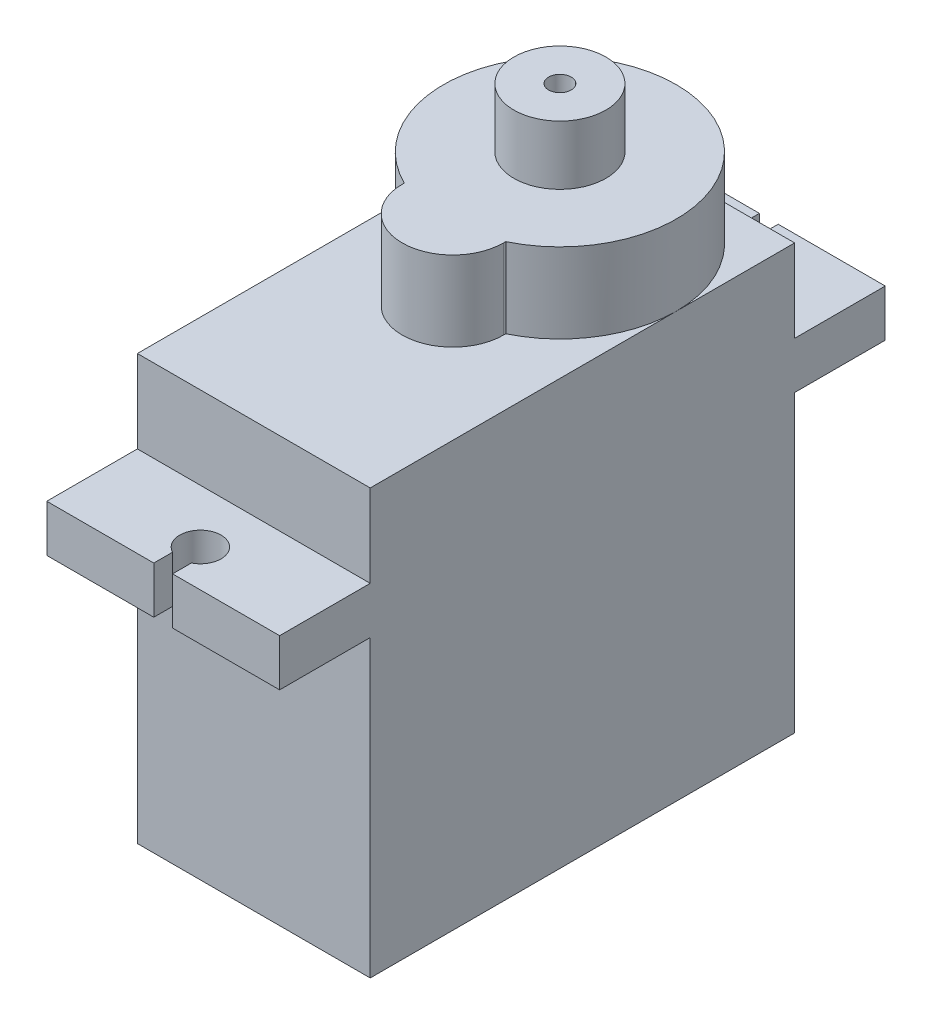
from build123d import *

# Parameters (mm, degrees)
IZIM1_W                     = 12.4
IZIM1_H                     = 22.6
Y_KSEKLIK_EKSTR_ZYON1_DEPTH = 22.6
Y_KSEKLIK_EKSTR_ZYON2_DEPTH = 2.5
IZIM3_W                     = 3.6
IZIM3_H                     = 3
Y_KSEKLIK_EKSTR_ZYON3_DEPTH = 1.2
IZIM4_R                     = 6.2
Y_KSEKLIK_EKSTR_ZYON4_DEPTH = 4.25
IZIM5_R                     = 2.45
IZIM5_R_2                   = 0.6
Y_KSEKLIK_EKSTR_ZYON6_DEPTH = 3.15
IZIM6_W                     = 0.1
IZIM6_H                     = 1.2
KES_EKSTR_ZYON1_DEPTH       = 3
RADYUS1_R                   = 0.5


with BuildPart() as part:
    # Çizim1 → Yükseklik-Ekstrüzyon1 (new body)
    with BuildSketch(Plane(origin=(0, 0, 0), x_dir=(1, 0, 0), z_dir=(0, 1, 0))):
        Rectangle(IZIM1_W, IZIM1_H)
    extrude(amount=Y_KSEKLIK_EKSTR_ZYON1_DEPTH)

    # Çizim2 → Yükseklik-Ekstrüzyon2 (add)
    with BuildSketch(Plane(origin=(0, 18.2, 0), x_dir=(1, 0, 0), z_dir=(0, 1, 0))):
        with BuildLine():
            Line((-6.2, 16.125), (-6.2, -16.125))
            Line((-6.2, -16.125), (-0.5, -16.125))
            Line((-0.5, -16.125), (-0.5, -15.125))
            ThreePointArc((-0.5, -15.125), (-0.574456265, -13.207120951), (1.1, -14.145204103))
            ThreePointArc((1.1, -14.145204103), (0.938083152, -14.719660368), (0.5, -15.125))
            Line((0.5, -15.125), (0.5, -16.125))
            Line((0.5, -16.125), (6.2, -16.125))
            Line((6.2, -16.125), (6.2, 16.125))
            Line((6.2, 16.125), (0.5, 16.125))
            Line((0.5, 16.125), (0.5, 15.125))
            ThreePointArc((0.5, 15.125), (0.938083152, 14.719660368), (1.1, 14.145204103))
            ThreePointArc((1.1, 14.145204103), (-0.574456265, 13.207120951), (-0.5, 15.125))
            Line((-0.5, 15.125), (-0.5, 16.125))
            Line((-0.5, 16.125), (-6.2, 16.125))
        make_face()
    extrude(amount=-Y_KSEKLIK_EKSTR_ZYON2_DEPTH)

    # Çizim3 → Yükseklik-Ekstrüzyon3 (add)
    with BuildSketch(Plane(origin=(0, 4.8, 0), x_dir=(-1, 0, 0), z_dir=(0, -1, 0))):
        with Locations((0, 12.8)):
            Rectangle(IZIM3_W, IZIM3_H)
    extrude(amount=Y_KSEKLIK_EKSTR_ZYON3_DEPTH)

    # Çizim4 → Yükseklik-Ekstrüzyon4 (add)
    with BuildSketch(Plane(origin=(0, 22.6, 0), x_dir=(1, 0, 0), z_dir=(0, 1, 0))):
        with Locations((0, 5)):
            Circle(IZIM4_R)
        with BuildLine():
            Line((-2.7, -0.581218505), (-2.7, -0.7))
            ThreePointArc((-2.7, -0.7), (0, -3.4), (2.7, -0.7))
            Line((2.7, -0.7), (2.7, -0.581218505))
            ThreePointArc((2.7, -0.581218505), (0, -1.2), (-2.7, -0.581218505))
        make_face()
    extrude(amount=Y_KSEKLIK_EKSTR_ZYON4_DEPTH)

    # Çizim5 → Yükseklik-Ekstrüzyon6 (add)
    with BuildSketch(Plane(origin=(0, 26.85, 0), x_dir=(1, 0, 0), z_dir=(0, 1, 0))):
        with Locations(Location((0, 5, 0), (0, 0, 90))):
            Circle(IZIM5_R)
        with Locations(Location((0, 5, 0), (0, 0, 270))):
            Circle(IZIM5_R_2, mode=Mode.SUBTRACT)
    extrude(amount=Y_KSEKLIK_EKSTR_ZYON6_DEPTH)

    # Çizim6 → Kes-Ekstrüzyon1 (cut)
    with BuildSketch(Plane(origin=(0, 0, -14.3), x_dir=(-1, 0, 0), z_dir=(0, 0, -1))):
        with Locations((-0.616666667, 4.2)):
            Rectangle(IZIM6_W, IZIM6_H)
        with Locations((0.616666667, 4.2)):
            Rectangle(IZIM6_W, IZIM6_H)
    extrude(amount=-KES_EKSTR_ZYON1_DEPTH, mode=Mode.SUBTRACT)

    # Radyus1
    radyus1_edges = [part.edges().sort_by_distance(p)[0] for p in [
        (0.566666667, 3.6, -12.8),
        (0.566666667, 4.8, -12.8),
        (0.666666667, 4.8, -12.8),
        (0.666666667, 3.6, -12.8),
        (-0.666666667, 3.6, -12.8),
        (-0.666666667, 4.8, -12.8),
        (-0.566666667, 4.8, -12.8),
        (-0.566666667, 3.6, -12.8),
        (1.8, 4.8, -12.8),
        (-1.8, 4.8, -12.8),
        (1.8, 3.6, -12.8),
        (-1.8, 3.6, -12.8),
    ]]
    fillet(radyus1_edges, radius=RADYUS1_R)


solid = part.part
